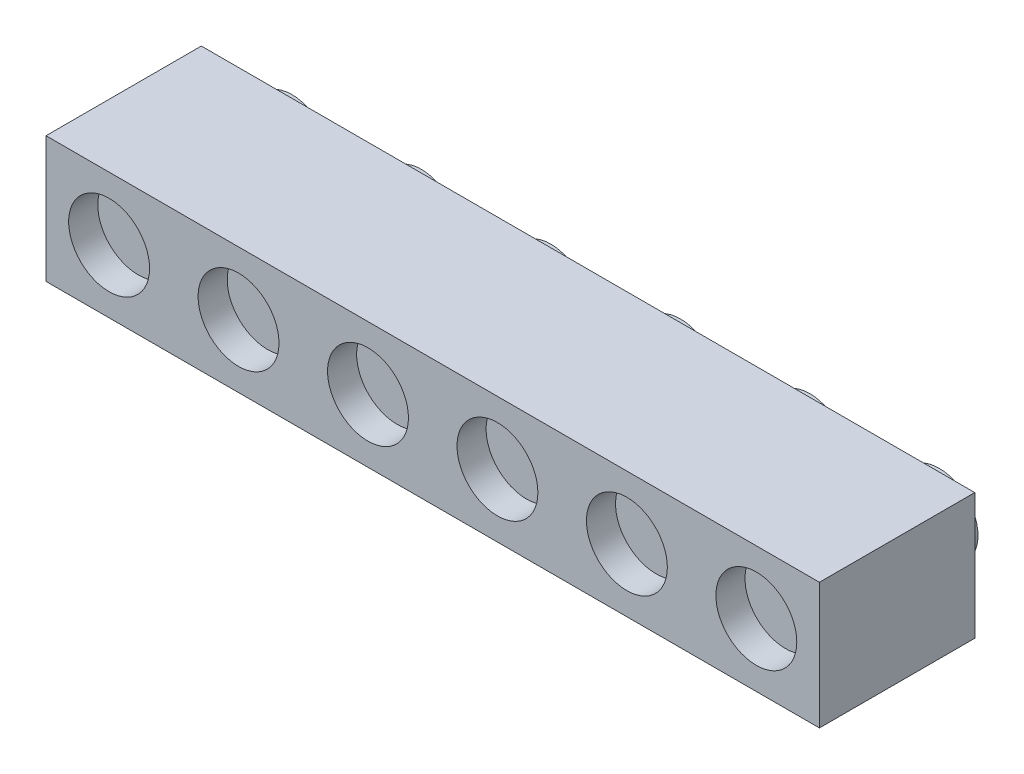
from build123d import *

# Parameters (mm, degrees)
SKETCH_1_W          = 47.8
SKETCH_1_H          = 7.8
EXTRUDE_1_DEPTH     = 9.6
SKETCH_2_R          = 2.4
EXTRUDE_2_DEPTH     = 1.7
SKETCH_4_R          = 2.5
CUT_EXTRUDE_1_DEPTH = 1.8


with BuildPart() as part:
    # Эскиз1 → Бобышка-Вытянуть1 (new body)
    with BuildSketch(Plane.XY):
        Rectangle(SKETCH_1_W, SKETCH_1_H)
    extrude(amount=EXTRUDE_1_DEPTH)

    # Эскиз2 → Бобышка-Вытянуть2 (add)
    with BuildSketch(Plane(origin=(0, 0, 0), x_dir=(-1, 0, 0), z_dir=(0, 0, -1))):
        with Locations(Location((-20, 0, 0), (0, 0, 180))):
            Circle(SKETCH_2_R)
        with Locations(Location((-12, 0, 0), (0, 0, 180))):
            Circle(SKETCH_2_R)
        with Locations(Location((-4, 0, 0), (0, 0, 180))):
            Circle(SKETCH_2_R)
        with Locations(Location((4, 0, 0), (0, 0, 180))):
            Circle(SKETCH_2_R)
        with Locations(Location((12, 0, 0), (0, 0, 180))):
            Circle(SKETCH_2_R)
        with Locations(Location((20, 0, 0), (0, 0, 180))):
            Circle(SKETCH_2_R)
    extrude(amount=EXTRUDE_2_DEPTH)

    # Эскиз4 → Вырез-Вытянуть1 (cut)
    with BuildSketch(Plane.XY.offset(9.6)):
        with Locations((-20, 0)):
            Circle(SKETCH_4_R)
        with Locations((-12, 0)):
            Circle(SKETCH_4_R)
        with Locations((-4, 0)):
            Circle(SKETCH_4_R)
        with Locations((4, 0)):
            Circle(SKETCH_4_R)
        with Locations((12, 0)):
            Circle(SKETCH_4_R)
        with Locations((20, 0)):
            Circle(SKETCH_4_R)
    extrude(amount=-CUT_EXTRUDE_1_DEPTH, mode=Mode.SUBTRACT)


solid = part.part
